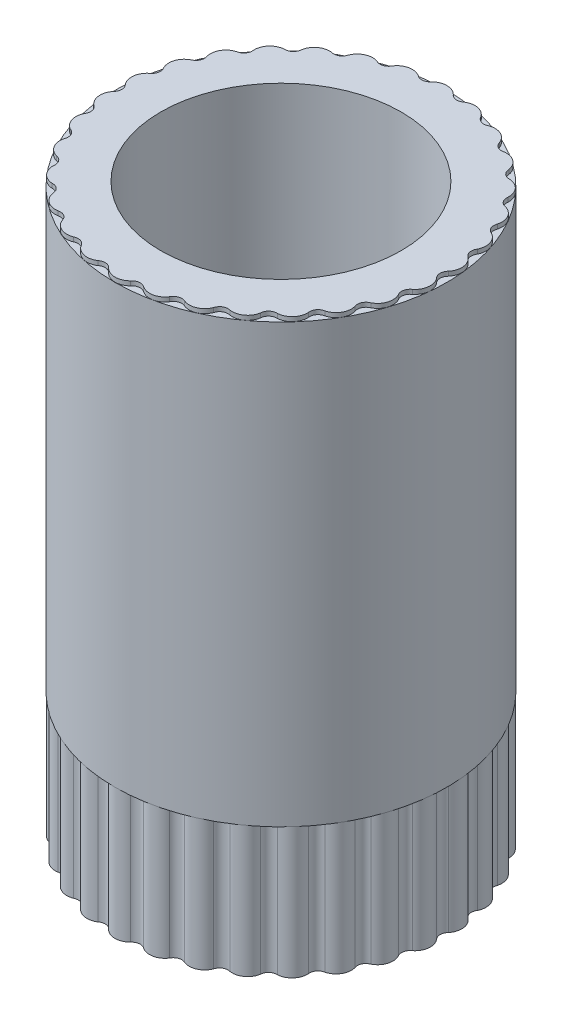
from build123d import *

# Parameters (mm, degrees)
BOSS_EXTRUDE2_DEPTH      = 1
BOSS_EXTRUDE2_DEPTH_BACK = 130
SKETCH7_R                = 27.493094195
CUT_EXTRUDE1_START       = -100
SKETCH11_R               = 38
SKETCH11_R_2             = 27.493094195
CUT_EXTRUDE1_DEPTH       = 100
SKETCH12_R               = 38
SKETCH12_R_2             = 27.493094195
BOSS_EXTRUDE3_DEPTH      = 100


with BuildPart() as part:
    # Sketch7 → Boss-Extrude2 (new, two sides: drawn at the far end of the back side and taken through both)
    with BuildSketch(Plane(origin=(0, 195, 0), x_dir=(1, 0, 0), z_dir=(0, 1, 0)).offset(-BOSS_EXTRUDE2_DEPTH_BACK)):
        with BuildLine():
            ThreePointArc((469.000007042, -36.915443923), (471.500007042, -37.950977828), (474.000007042, -36.915443923))
            ThreePointArc((474.000007042, -36.915443923), (475.305477345, -36.206631381), (476.729790403, -36.62853213))
            ThreePointArc((476.729790403, -36.62853213), (479.390459011, -37.121657908), (481.620528407, -35.588973676))
            ThreePointArc((481.620528407, -35.588973676), (482.750100638, -34.624227851), (484.231007137, -34.74077772))
            ThreePointArc((484.231007137, -34.74077772), (486.936060365, -34.669943408), (488.798734425, -32.707094505))
            ThreePointArc((488.798734425, -32.707094505), (489.703040856, -31.528579418), (491.175818076, -31.334684619))
            ThreePointArc((491.175818076, -31.334684619), (493.80703212, -30.702986016), (495.220903048, -28.395758358))
            ThreePointArc((495.220903048, -28.395758358), (495.86042115, -27.054980774), (497.260701657, -26.55911544))
            ThreePointArc((497.260701657, -26.55911544), (499.703079837, -25.394160806), (500.606354689, -22.843391312))
            ThreePointArc((500.606354689, -22.843391312), (500.953134452, -21.398949646), (502.219719271, -20.622785471))
            ThreePointArc((502.219719271, -20.622785471), (504.36651794, -18.975488914), (504.719719271, -16.292658452))
            ThreePointArc((504.719719271, -16.292658452), (504.758604755, -14.807681735), (505.836138051, -13.785140818))
            ThreePointArc((505.836138051, -13.785140818), (507.593531806, -11.727497102), (507.381223022, -9.029858236))
            ThreePointArc((507.381223022, -9.029858236), (507.110514745, -7.569247077), (507.951903142, -6.345019362))
            ThreePointArc((507.951903142, -6.345019362), (509.243085443, -3.966957392), (508.474545458, -1.372409886))
            ThreePointArc((508.474545458, -1.372409886), (507.906074671, 0), (508.474545458, 1.372409886))
            ThreePointArc((508.474545458, 1.372409886), (509.243085443, 3.966957392), (507.951903142, 6.345019362))
            ThreePointArc((507.951903142, 6.345019362), (507.110514745, 7.569247077), (507.381223022, 9.029858236))
            ThreePointArc((507.381223022, 9.029858236), (507.593531806, 11.727497102), (505.836138051, 13.785140818))
            ThreePointArc((505.836138051, 13.785140818), (504.758604755, 14.807681735), (504.719719271, 16.292658452))
            ThreePointArc((504.719719271, 16.292658452), (504.36651794, 18.975488914), (502.219719271, 20.622785471))
            ThreePointArc((502.219719271, 20.622785471), (500.953134452, 21.398949646), (500.606354689, 22.843391312))
            ThreePointArc((500.606354689, 22.843391312), (499.703079837, 25.394160806), (497.260701657, 26.55911544))
            ThreePointArc((497.260701657, 26.55911544), (495.86042115, 27.054980774), (495.220903048, 28.395758358))
            ThreePointArc((495.220903048, 28.395758358), (493.80703212, 30.702986016), (491.175818076, 31.334684619))
            ThreePointArc((491.175818076, 31.334684619), (489.703040856, 31.528579418), (488.798734425, 32.707094505))
            ThreePointArc((488.798734425, 32.707094505), (486.936060365, 34.669943408), (484.231007137, 34.74077772))
            ThreePointArc((484.231007137, 34.74077772), (482.750100638, 34.624227851), (481.620528407, 35.588973676))
            ThreePointArc((481.620528407, 35.588973676), (479.390459011, 37.121657908), (476.729790403, 36.62853213))
            ThreePointArc((476.729790403, 36.62853213), (475.305477345, 36.206631381), (474.000007042, 36.915443923))
            ThreePointArc((474.000007042, 36.915443923), (471.500007042, 37.950977828), (469.000007042, 36.915443923))
            ThreePointArc((469.000007042, 36.915443923), (467.694536739, 36.206631381), (466.270223681, 36.62853213))
            ThreePointArc((466.270223681, 36.62853213), (463.609555074, 37.121657908), (461.379485677, 35.588973676))
            ThreePointArc((461.379485677, 35.588973676), (460.249913446, 34.624227851), (458.769006947, 34.74077772))
            ThreePointArc((458.769006947, 34.74077772), (456.063953719, 34.669943408), (454.201279659, 32.707094505))
            ThreePointArc((454.201279659, 32.707094505), (453.296973228, 31.528579418), (451.824196008, 31.334684619))
            ThreePointArc((451.824196008, 31.334684619), (449.192981964, 30.702986016), (447.779111037, 28.395758358))
            ThreePointArc((447.779111037, 28.395758358), (447.139592935, 27.054980774), (445.739312427, 26.55911544))
            ThreePointArc((445.739312427, 26.55911544), (443.296934247, 25.394160806), (442.393659395, 22.843391312))
            ThreePointArc((442.393659395, 22.843391312), (442.046879632, 21.398949646), (440.780294813, 20.622785471))
            ThreePointArc((440.780294813, 20.622785471), (438.633496144, 18.975488914), (438.280294813, 16.292658452))
            ThreePointArc((438.280294813, 16.292658452), (438.241409329, 14.807681735), (437.163876034, 13.785140818))
            ThreePointArc((437.163876034, 13.785140818), (435.406482279, 11.727497102), (435.618791062, 9.029858236))
            ThreePointArc((435.618791062, 9.029858236), (435.889499339, 7.569247077), (435.048110942, 6.345019362))
            ThreePointArc((435.048110942, 6.345019362), (433.756928641, 3.966957392), (434.525468626, 1.372409886))
            ThreePointArc((434.525468626, 1.372409886), (435.093939413, 0), (434.525468626, -1.372409886))
            ThreePointArc((434.525468626, -1.372409886), (433.756928641, -3.966957392), (435.048110942, -6.345019362))
            ThreePointArc((435.048110942, -6.345019362), (435.889499339, -7.569247077), (435.618791062, -9.029858236))
            ThreePointArc((435.618791062, -9.029858236), (435.406482279, -11.727497102), (437.163876034, -13.785140818))
            ThreePointArc((437.163876034, -13.785140818), (438.241409329, -14.807681735), (438.280294813, -16.292658452))
            ThreePointArc((438.280294813, -16.292658452), (438.633496144, -18.975488914), (440.780294813, -20.622785471))
            ThreePointArc((440.780294813, -20.622785471), (442.046879632, -21.398949646), (442.393659395, -22.843391312))
            ThreePointArc((442.393659395, -22.843391312), (443.296934247, -25.394160806), (445.739312427, -26.55911544))
            ThreePointArc((445.739312427, -26.55911544), (447.139592935, -27.054980774), (447.779111037, -28.395758358))
            ThreePointArc((447.779111037, -28.395758358), (449.192981964, -30.702986016), (451.824196008, -31.334684619))
            ThreePointArc((451.824196008, -31.334684619), (453.296973228, -31.528579418), (454.201279659, -32.707094505))
            ThreePointArc((454.201279659, -32.707094505), (456.063953719, -34.669943408), (458.769006947, -34.74077772))
            ThreePointArc((458.769006947, -34.74077772), (460.249913446, -34.624227851), (461.379485677, -35.588973676))
            ThreePointArc((461.379485677, -35.588973676), (463.609555074, -37.121657908), (466.270223681, -36.62853213))
            ThreePointArc((466.270223681, -36.62853213), (467.694536739, -36.206631381), (469.000007042, -36.915443923))
        make_face()
        with Locations(Location((471.500007042, 0, 0), (0, 0, 270))):
            Circle(SKETCH7_R, mode=Mode.SUBTRACT)
    extrude(amount=BOSS_EXTRUDE2_DEPTH + BOSS_EXTRUDE2_DEPTH_BACK)

    # Sketch11 → Cut-Extrude1 (cut)
    with BuildSketch(Plane(origin=(0, 195, 0), x_dir=(1, 0, 0), z_dir=(0, 1, 0)).offset(CUT_EXTRUDE1_START)):
        with Locations((471.500007042, 0)):
            Circle(SKETCH11_R)
        with Locations(Location((471.500007042, 0, 0), (0, 0, 270))):
            Circle(SKETCH11_R_2, mode=Mode.SUBTRACT)
    extrude(amount=CUT_EXTRUDE1_DEPTH, mode=Mode.SUBTRACT)


with BuildPart() as cut_extrude1_piece_1:
    # of the separate pieces the step leaves, piece 1, a body of its own (cut_extrude1_pieces)
    add(part.part.solids().sort_by_distance((458.769006947, 95, 34.74077772))[0])



with BuildPart() as cut_extrude1_piece_2:
    # of the separate pieces the step leaves, piece 2, a body of its own (cut_extrude1_pieces)
    add(part.part.solids().sort_by_distance((458.769006947, 196, 34.74077772))[0])


with BuildPart() as cut_extrude1_piece_1_1:
    add(cut_extrude1_piece_1.part)

    add(cut_extrude1_piece_2.part)  # Boss-Extrude3 merges Cut-Extrude1 piece 2
    # Sketch12 → Boss-Extrude3 (add)
    with BuildSketch(Plane(origin=(0, 195, 0), x_dir=(1, 0, 0), z_dir=(0, 1, 0))):
        with Locations(Location((471.500007042, 0, 0), (0, 0, 270))):
            Circle(SKETCH12_R)
        with Locations(Location((471.500007042, 0, 0), (0, 0, 270))):
            Circle(SKETCH12_R_2, mode=Mode.SUBTRACT)
    extrude(amount=-BOSS_EXTRUDE3_DEPTH)


solid = cut_extrude1_piece_1_1.part
